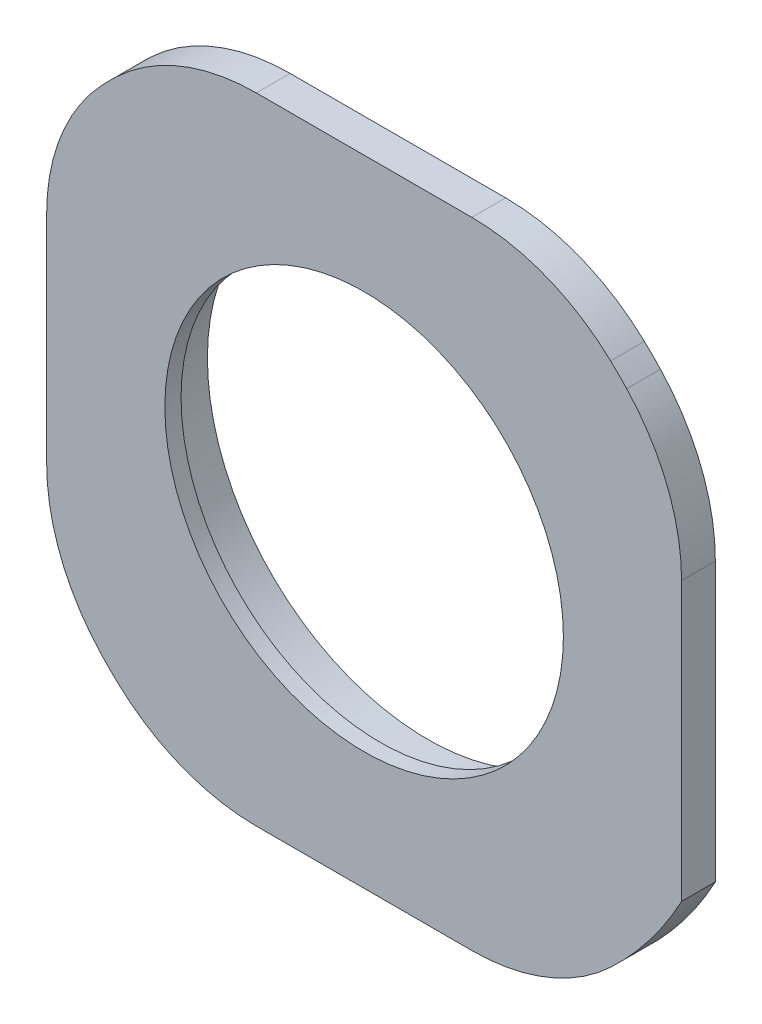
from build123d import *

# Parameters (mm, degrees)
SKETCH1_R               = 36
BOSS_EXTRUDE1_DEPTH     = 5
BOSS_EXTRUDE2_START     = -4.4
BOSS_EXTRUDE2_DEPTH     = 4.4
BOSS_EXTRUDE3_START     = -5
BOSS_EXTRUDE3_DEPTH     = 5
BOSS_EXTRUDE4_START     = 4.4
SKETCH3_R               = 32.7
SKETCH3_R_2             = 32.6
BOSS_EXTRUDE4_DEPTH     = 4.4
CUT_EXTRUDE1_DEPTH      = 68.129427228
CUT_EXTRUDE1_DEPTH_BACK = 68.129427228
SKETCH4_R               = 32.6
BOSS_EXTRUDE5_START     = -2.4
SKETCH5_R               = 29.5
BOSS_EXTRUDE5_DEPTH     = 2.4


with BuildPart() as part:
    # Sketch1 → Boss-Extrude1 (new body)
    # profile 1 of 3: a face of its own
    with BuildSketch(Plane.XY):
        with BuildLine():
            Line((15.957693357, 47), (-15.957693357, 47))
            ThreePointArc((-15.957693357, 47), (-26.99865268, 44.894394011), (-36.489751331, 38.873147815))
            ThreePointArc((-36.489751331, 38.873147815), (-37.700288946, 37.700288946), (-38.873147815, 36.489751331))
            ThreePointArc((-38.873147815, 36.489751331), (-44.894394011, 26.99865268), (-47, 15.957693357))
            Line((-47, 15.957693357), (-47, -15.957693357))
            ThreePointArc((-47, -15.957693357), (-44.894394011, -26.99865268), (-38.873147815, -36.489751331))
            ThreePointArc((-38.873147815, -36.489751331), (-37.700288946, -37.700288946), (-36.489751331, -38.873147815))
            ThreePointArc((-36.489751331, -38.873147815), (-26.99865268, -44.894394011), (-15.957693357, -47))
            Line((-15.957693357, -47), (15.957693357, -47))
            ThreePointArc((15.957693357, -47), (26.99865268, -44.894394011), (36.489751331, -38.873147815))
            ThreePointArc((36.489751331, -38.873147815), (42.303260219, -32.45085127), (47, -25.171880606))
            Line((47, -25.171880606), (47, 15.957693357))
            ThreePointArc((47, 15.957693357), (44.894394011, 26.99865268), (38.873147815, 36.489751331))
            ThreePointArc((38.873147815, 36.489751331), (37.700288946, 37.700288946), (36.489751331, 38.873147815))
            ThreePointArc((36.489751331, 38.873147815), (26.99865268, 44.894394011), (15.957693357, 47))
        make_face()
        Circle(SKETCH1_R, mode=Mode.SUBTRACT)
    # profile 2 of 3: a face of its own
    with BuildSketch(Plane.XY):
        with BuildLine():
            ThreePointArc((35.529282793, -5.802591166), (35.882127728, -2.910826297), (36, 0))
            ThreePointArc((36, 0), (35.999320343, 0.221212273), (35.997281396, 0.442416194))
            ThreePointArc((35.997281396, 0.442416194), (33.655628155, 2.522140659), (35.661160217, 4.927641625))
            ThreePointArc((35.661160217, 4.927641625), (35.097404839, 8.010753622), (34.267618722, 11.03314584))
            ThreePointArc((34.267618722, 11.03314584), (31.416989017, 12.330259572), (32.62438706, 15.220031833))
            ThreePointArc((32.62438706, 15.220031833), (31.176914536, 18), (29.493127743, 20.64353206))
            ThreePointArc((29.493127743, 20.64353206), (26.386812533, 21.042780813), (26.688793942, 24.16005542))
            ThreePointArc((26.688793942, 24.16005542), (24.48621856, 26.389867386), (22.098042936, 28.419649864))
            ThreePointArc((22.098042936, 28.419649864), (19.01205196, 27.885558633), (18.381784361, 30.953352059))
            ThreePointArc((18.381784361, 30.953352059), (15.619814608, 32.434879244), (12.739450039, 33.67055706))
            ThreePointArc((12.739450039, 33.67055706), (9.947987136, 32.250582195), (8.441472573, 34.996307531))
            ThreePointArc((8.441472573, 34.996307531), (5.365521582, 35.597909744), (2.248901099, 35.9296875))
            ThreePointArc((2.248901099, 35.9296875), (0, 33.75), (-2.248901099, 35.9296875))
            ThreePointArc((-2.248901099, 35.9296875), (-5.365521582, 35.597909744), (-8.441472573, 34.996307531))
            ThreePointArc((-8.441472573, 34.996307531), (-9.947987136, 32.250582195), (-12.739450039, 33.67055706))
            ThreePointArc((-12.739450039, 33.67055706), (-15.619814608, 32.434879244), (-18.381784361, 30.953352059))
            ThreePointArc((-18.381784361, 30.953352059), (-19.01205196, 27.885558633), (-22.098042936, 28.419649864))
            ThreePointArc((-22.098042936, 28.419649864), (-24.48621856, 26.389867386), (-26.688793942, 24.16005542))
            ThreePointArc((-26.688793942, 24.16005542), (-26.386812533, 21.042780813), (-29.493127743, 20.64353206))
            ThreePointArc((-29.493127743, 20.64353206), (-31.176914536, 18), (-32.62438706, 15.220031833))
            ThreePointArc((-32.62438706, 15.220031833), (-31.416989017, 12.330259572), (-34.267618722, 11.03314584))
            ThreePointArc((-34.267618722, 11.03314584), (-35.097404839, 8.010753622), (-35.661160217, 4.927641625))
            ThreePointArc((-35.661160217, 4.927641625), (-33.655628155, 2.522140659), (-35.997281396, 0.442416194))
            ThreePointArc((-35.997281396, 0.442416194), (-35.899336699, -2.690283369), (-35.529282793, -5.802591166))
            ThreePointArc((-35.529282793, -5.802591166), (-32.903817036, -7.510081521), (-34.528427647, -10.187624072))
            ThreePointArc((-34.528427647, -10.187624072), (-33.511454951, -13.152276877), (-32.240472674, -16.017238268))
            ThreePointArc((-32.240472674, -16.017238268), (-29.228357378, -16.875), (-29.991571576, -19.912449232))
            ThreePointArc((-29.991571576, -19.912449232), (-28.145933369, -22.445632867), (-26.086955074, -24.808683459))
            ThreePointArc((-26.086955074, -24.808683459), (-22.9558299, -24.740500674), (-22.789832754, -27.867965894))
            ThreePointArc((-22.789832754, -27.867965894), (-20.27952209, -29.744595875), (-17.615497035, -31.395768253))
            ThreePointArc((-17.615497035, -31.395768253), (-14.643576195, -30.407699292), (-13.563117281, -33.347291489))
            ThreePointArc((-13.563117281, -33.347291489), (-10.611186279, -34.400621008), (-7.57882478, -35.19320126))
            ThreePointArc((-7.57882478, -35.19320126), (-5.030176483, -33.373040385), (-3.131259316, -35.863563893))
            ThreePointArc((-3.131259316, -35.863563893), (0, -36), (3.131259316, -35.863563893))
            ThreePointArc((3.131259316, -35.863563893), (5.030176483, -33.373040385), (7.57882478, -35.19320126))
            ThreePointArc((7.57882478, -35.19320126), (10.611186279, -34.400621008), (13.563117281, -33.347291489))
            ThreePointArc((13.563117281, -33.347291489), (14.643576195, -30.407699292), (17.615497035, -31.395768253))
            ThreePointArc((17.615497035, -31.395768253), (20.27952209, -29.744595875), (22.789832754, -27.867965894))
            ThreePointArc((22.789832754, -27.867965894), (22.9558299, -24.740500674), (26.086955074, -24.808683459))
            ThreePointArc((26.086955074, -24.808683459), (28.145933369, -22.445632867), (29.991571576, -19.912449232))
            ThreePointArc((29.991571576, -19.912449232), (29.228357378, -16.875), (32.240472674, -16.017238268))
            ThreePointArc((32.240472674, -16.017238268), (33.511454951, -13.152276877), (34.528427647, -10.187624072))
            ThreePointArc((34.528427647, -10.187624072), (32.903817036, -7.510081521), (35.529282793, -5.802591166))
        make_face()
        with BuildLine():
            ThreePointArc((-32.7, 0), (0, 32.7), (32.7, 0))
            ThreePointArc((32.7, 0), (0, -32.7), (-32.7, 0))
        make_face(mode=Mode.SUBTRACT)
    # profile 3 of 3: a face of its own
    with BuildSketch(Plane.XY):
        with BuildLine():
            ThreePointArc((32.7, 0), (0, 32.7), (-32.7, 0))
            ThreePointArc((-32.7, 0), (0, -32.7), (32.7, 0))
        make_face()
    extrude(amount=BOSS_EXTRUDE1_DEPTH)

    # Sketch1<4> → Boss-Extrude2 (add)
    with BuildSketch(Plane.XY.offset(BOSS_EXTRUDE2_START)):
        with BuildLine():
            ThreePointArc((35.529282793, -5.802591166), (35.882127728, -2.910826297), (36, 0))
            ThreePointArc((36, 0), (35.999320343, 0.221212273), (35.997281396, 0.442416194))
            ThreePointArc((35.997281396, 0.442416194), (33.655628155, 2.522140659), (35.661160217, 4.927641625))
            ThreePointArc((35.661160217, 4.927641625), (35.097404839, 8.010753622), (34.267618722, 11.03314584))
            ThreePointArc((34.267618722, 11.03314584), (31.416989017, 12.330259572), (32.62438706, 15.220031833))
            ThreePointArc((32.62438706, 15.220031833), (31.176914536, 18), (29.493127743, 20.64353206))
            ThreePointArc((29.493127743, 20.64353206), (26.386812533, 21.042780813), (26.688793942, 24.16005542))
            ThreePointArc((26.688793942, 24.16005542), (24.48621856, 26.389867386), (22.098042936, 28.419649864))
            ThreePointArc((22.098042936, 28.419649864), (19.01205196, 27.885558633), (18.381784361, 30.953352059))
            ThreePointArc((18.381784361, 30.953352059), (15.619814608, 32.434879244), (12.739450039, 33.67055706))
            ThreePointArc((12.739450039, 33.67055706), (9.947987136, 32.250582195), (8.441472573, 34.996307531))
            ThreePointArc((8.441472573, 34.996307531), (5.365521582, 35.597909744), (2.248901099, 35.9296875))
            ThreePointArc((2.248901099, 35.9296875), (0, 33.75), (-2.248901099, 35.9296875))
            ThreePointArc((-2.248901099, 35.9296875), (-5.365521582, 35.597909744), (-8.441472573, 34.996307531))
            ThreePointArc((-8.441472573, 34.996307531), (-9.947987136, 32.250582195), (-12.739450039, 33.67055706))
            ThreePointArc((-12.739450039, 33.67055706), (-15.619814608, 32.434879244), (-18.381784361, 30.953352059))
            ThreePointArc((-18.381784361, 30.953352059), (-19.01205196, 27.885558633), (-22.098042936, 28.419649864))
            ThreePointArc((-22.098042936, 28.419649864), (-24.48621856, 26.389867386), (-26.688793942, 24.16005542))
            ThreePointArc((-26.688793942, 24.16005542), (-26.386812533, 21.042780813), (-29.493127743, 20.64353206))
            ThreePointArc((-29.493127743, 20.64353206), (-31.176914536, 18), (-32.62438706, 15.220031833))
            ThreePointArc((-32.62438706, 15.220031833), (-31.416989017, 12.330259572), (-34.267618722, 11.03314584))
            ThreePointArc((-34.267618722, 11.03314584), (-35.097404839, 8.010753622), (-35.661160217, 4.927641625))
            ThreePointArc((-35.661160217, 4.927641625), (-33.655628155, 2.522140659), (-35.997281396, 0.442416194))
            ThreePointArc((-35.997281396, 0.442416194), (-35.899336699, -2.690283369), (-35.529282793, -5.802591166))
            ThreePointArc((-35.529282793, -5.802591166), (-32.903817036, -7.510081521), (-34.528427647, -10.187624072))
            ThreePointArc((-34.528427647, -10.187624072), (-33.511454951, -13.152276877), (-32.240472674, -16.017238268))
            ThreePointArc((-32.240472674, -16.017238268), (-29.228357378, -16.875), (-29.991571576, -19.912449232))
            ThreePointArc((-29.991571576, -19.912449232), (-28.145933369, -22.445632867), (-26.086955074, -24.808683459))
            ThreePointArc((-26.086955074, -24.808683459), (-22.9558299, -24.740500674), (-22.789832754, -27.867965894))
            ThreePointArc((-22.789832754, -27.867965894), (-20.27952209, -29.744595875), (-17.615497035, -31.395768253))
            ThreePointArc((-17.615497035, -31.395768253), (-14.643576195, -30.407699292), (-13.563117281, -33.347291489))
            ThreePointArc((-13.563117281, -33.347291489), (-10.611186279, -34.400621008), (-7.57882478, -35.19320126))
            ThreePointArc((-7.57882478, -35.19320126), (-5.030176483, -33.373040385), (-3.131259316, -35.863563893))
            ThreePointArc((-3.131259316, -35.863563893), (0, -36), (3.131259316, -35.863563893))
            ThreePointArc((3.131259316, -35.863563893), (5.030176483, -33.373040385), (7.57882478, -35.19320126))
            ThreePointArc((7.57882478, -35.19320126), (10.611186279, -34.400621008), (13.563117281, -33.347291489))
            ThreePointArc((13.563117281, -33.347291489), (14.643576195, -30.407699292), (17.615497035, -31.395768253))
            ThreePointArc((17.615497035, -31.395768253), (20.27952209, -29.744595875), (22.789832754, -27.867965894))
            ThreePointArc((22.789832754, -27.867965894), (22.9558299, -24.740500674), (26.086955074, -24.808683459))
            ThreePointArc((26.086955074, -24.808683459), (28.145933369, -22.445632867), (29.991571576, -19.912449232))
            ThreePointArc((29.991571576, -19.912449232), (29.228357378, -16.875), (32.240472674, -16.017238268))
            ThreePointArc((32.240472674, -16.017238268), (33.511454951, -13.152276877), (34.528427647, -10.187624072))
            ThreePointArc((34.528427647, -10.187624072), (32.903817036, -7.510081521), (35.529282793, -5.802591166))
        make_face()
        with BuildLine():
            ThreePointArc((-32.7, 0), (0, 32.7), (32.7, 0))
            ThreePointArc((32.7, 0), (0, -32.7), (-32.7, 0))
        make_face(mode=Mode.SUBTRACT)
    extrude(amount=BOSS_EXTRUDE2_DEPTH)

    # Sketch2 → Boss-Extrude3 (add)
    with BuildSketch(Plane.XY.offset(5).offset(BOSS_EXTRUDE3_START)):
        with BuildLine():
            Line((15.957693357, 47), (-15.957693357, 47))
            ThreePointArc((-15.957693357, 47), (-26.99865268, 44.894394011), (-36.489751331, 38.873147815))
            ThreePointArc((-36.489751331, 38.873147815), (-37.700288946, 37.700288946), (-38.873147815, 36.489751331))
            ThreePointArc((-38.873147815, 36.489751331), (-44.894394011, 26.99865268), (-47, 15.957693357))
            Line((-47, 15.957693357), (-47, -15.957693357))
            ThreePointArc((-47, -15.957693357), (-44.894394011, -26.99865268), (-38.873147815, -36.489751331))
            ThreePointArc((-38.873147815, -36.489751331), (-37.700288946, -37.700288946), (-36.489751331, -38.873147815))
            ThreePointArc((-36.489751331, -38.873147815), (-26.99865268, -44.894394011), (-15.957693357, -47))
            Line((-15.957693357, -47), (15.957693357, -47))
            ThreePointArc((15.957693357, -47), (26.99865268, -44.894394011), (36.489751331, -38.873147815))
            ThreePointArc((36.489751331, -38.873147815), (42.303260219, -32.45085127), (47, -25.171880606))
            Line((47, -25.171880606), (47, 15.957693357))
            ThreePointArc((47, 15.957693357), (44.894394011, 26.99865268), (38.873147815, 36.489751331))
            ThreePointArc((38.873147815, 36.489751331), (37.700288946, 37.700288946), (36.489751331, 38.873147815))
            ThreePointArc((36.489751331, 38.873147815), (26.99865268, 44.894394011), (15.957693357, 47))
        make_face()
    extrude(amount=BOSS_EXTRUDE3_DEPTH)

    # Sketch3 → Boss-Extrude4 (add)
    with BuildSketch(Plane(origin=(0, 0, 0), x_dir=(-1, 0, 0), z_dir=(0, 0, -1)).offset(BOSS_EXTRUDE4_START)):
        Circle(SKETCH3_R)
        Circle(SKETCH3_R_2, mode=Mode.SUBTRACT)
    extrude(amount=-BOSS_EXTRUDE4_DEPTH)

    # Sketch4 → Cut-Extrude1 (cut, two sides: drawn at the far end of the back side and taken through both)
    with BuildSketch(Plane.XY.offset(5).offset(-CUT_EXTRUDE1_DEPTH_BACK)):
        Circle(SKETCH4_R)
    extrude(amount=CUT_EXTRUDE1_DEPTH + CUT_EXTRUDE1_DEPTH_BACK, mode=Mode.SUBTRACT)

    # Sketch5 → Boss-Extrude5 (add)
    with BuildSketch(Plane.XY.offset(5).offset(BOSS_EXTRUDE5_START)):
        with BuildLine():
            Line((15.957693357, 47), (-15.957693357, 47))
            ThreePointArc((-15.957693357, 47), (-26.99865268, 44.894394011), (-36.489751331, 38.873147815))
            ThreePointArc((-36.489751331, 38.873147815), (-37.700288946, 37.700288946), (-38.873147815, 36.489751331))
            ThreePointArc((-38.873147815, 36.489751331), (-44.894394011, 26.99865268), (-47, 15.957693357))
            Line((-47, 15.957693357), (-47, -15.957693357))
            ThreePointArc((-47, -15.957693357), (-44.894394011, -26.99865268), (-38.873147815, -36.489751331))
            ThreePointArc((-38.873147815, -36.489751331), (-37.700288946, -37.700288946), (-36.489751331, -38.873147815))
            ThreePointArc((-36.489751331, -38.873147815), (-26.99865268, -44.894394011), (-15.957693357, -47))
            Line((-15.957693357, -47), (15.957693357, -47))
            ThreePointArc((15.957693357, -47), (26.99865268, -44.894394011), (36.489751331, -38.873147815))
            ThreePointArc((36.489751331, -38.873147815), (42.303260219, -32.45085127), (47, -25.171880606))
            Line((47, -25.171880606), (47, 15.957693357))
            ThreePointArc((47, 15.957693357), (44.894394011, 26.99865268), (38.873147815, 36.489751331))
            ThreePointArc((38.873147815, 36.489751331), (37.700288946, 37.700288946), (36.489751331, 38.873147815))
            ThreePointArc((36.489751331, 38.873147815), (26.99865268, 44.894394011), (15.957693357, 47))
        make_face()
        Circle(SKETCH5_R, mode=Mode.SUBTRACT)
    extrude(amount=BOSS_EXTRUDE5_DEPTH)


solid = part.part
